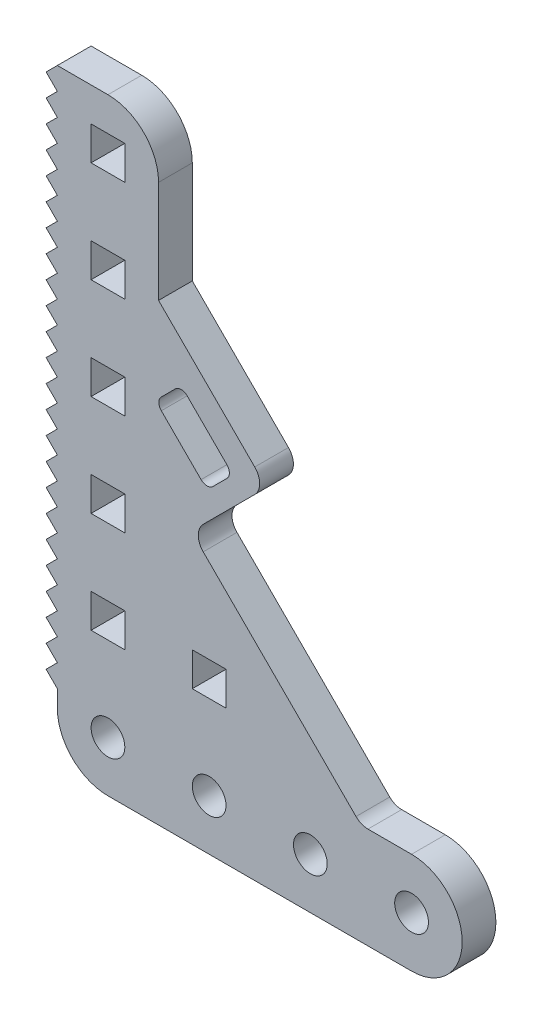
from build123d import *

# Parameters (mm, degrees)
MODEL_R                 = 1.5
MODEL_W                 = 3
MODEL_H                 = 3
SALIENTE_EXTRUIR1_DEPTH = 3


with BuildPart() as part:
    # Model → Saliente-Extruir1 (new body)
    with BuildSketch(Plane.XY):
        with BuildLine():
            Line((20.979107628, 285.503511394), (19.979107628, 286.503511394))
            Line((19.979107628, 286.503511394), (20.979107628, 287.503511394))
            Line((20.979107628, 287.503511394), (25.479107628, 287.503511394))
            ThreePointArc((25.479107628, 287.503511394), (28.661088143, 286.185491909), (29.979107628, 283.003511394))
            Line((29.979107628, 283.003511394), (29.979107628, 273.910365643))
            Line((29.979107628, 273.910365643), (38.532408487, 265.357064784))
            ThreePointArc((38.532408487, 265.357064784), (38.971748315, 264.296404613), (38.532408487, 263.235744441))
            Line((38.532408487, 263.235744441), (33.950301706, 258.65363766))
            ThreePointArc((33.950301706, 258.65363766), (33.510961878, 257.592977488), (33.950301706, 256.532317316))
            Line((33.950301706, 256.532317316), (47.5397678, 242.942851222))
            ThreePointArc((47.5397678, 242.942851222), (48.026402823, 242.617692095), (48.600427972, 242.503511394))
            Line((48.600427972, 242.503511394), (52.479107628, 242.503511394))
            ThreePointArc((52.479107628, 242.503511394), (56.979107628, 238.003511394), (52.479107628, 233.503511394))
            Line((52.479107628, 233.503511394), (25.479107628, 233.503511394))
            ThreePointArc((25.479107628, 233.503511394), (22.297127113, 234.821530879), (20.979107628, 238.003511394))
            Line((20.979107628, 238.003511394), (20.979107628, 239.503511394))
            Line((20.979107628, 239.503511394), (19.979107628, 240.503511394))
            Line((19.979107628, 240.503511394), (20.979107628, 241.503511394))
            Line((20.979107628, 241.503511394), (19.979107628, 242.503511394))
            Line((19.979107628, 242.503511394), (20.979107628, 243.503511394))
            Line((20.979107628, 243.503511394), (19.979107628, 244.503511394))
            Line((19.979107628, 244.503511394), (20.979107628, 245.503511394))
            Line((20.979107628, 245.503511394), (19.979107628, 246.503511394))
            Line((19.979107628, 246.503511394), (20.979107628, 247.503511394))
            Line((20.979107628, 247.503511394), (19.979107628, 248.503511394))
            Line((19.979107628, 248.503511394), (20.979107628, 249.503511394))
            Line((20.979107628, 249.503511394), (19.979107628, 250.503511394))
            Line((19.979107628, 250.503511394), (20.979107628, 251.503511394))
            Line((20.979107628, 251.503511394), (19.979107628, 252.503511394))
            Line((19.979107628, 252.503511394), (20.979107628, 253.503511394))
            Line((20.979107628, 253.503511394), (19.979107628, 254.503511394))
            Line((19.979107628, 254.503511394), (20.979107628, 255.503511394))
            Line((20.979107628, 255.503511394), (19.979107628, 256.503511394))
            Line((19.979107628, 256.503511394), (20.979107628, 257.503511394))
            Line((20.979107628, 257.503511394), (19.979107628, 258.503511394))
            Line((19.979107628, 258.503511394), (20.979107628, 259.503511394))
            Line((20.979107628, 259.503511394), (19.979107628, 260.503511394))
            Line((19.979107628, 260.503511394), (20.979107628, 261.503511394))
            Line((20.979107628, 261.503511394), (19.979107628, 262.503511394))
            Line((19.979107628, 262.503511394), (20.979107628, 263.503511394))
            Line((20.979107628, 263.503511394), (19.979107628, 264.503511394))
            Line((19.979107628, 264.503511394), (20.979107628, 265.503511394))
            Line((20.979107628, 265.503511394), (19.979107628, 266.503511394))
            Line((19.979107628, 266.503511394), (20.979107628, 267.503511394))
            Line((20.979107628, 267.503511394), (19.979107628, 268.503511394))
            Line((19.979107628, 268.503511394), (20.979107628, 269.503511394))
            Line((20.979107628, 269.503511394), (19.979107628, 270.503511394))
            Line((19.979107628, 270.503511394), (20.979107628, 271.503511394))
            Line((20.979107628, 271.503511394), (19.979107628, 272.503511394))
            Line((19.979107628, 272.503511394), (20.979107628, 273.503511394))
            Line((20.979107628, 273.503511394), (19.979107628, 274.503511394))
            Line((19.979107628, 274.503511394), (20.979107628, 275.503511394))
            Line((20.979107628, 275.503511394), (19.979107628, 276.503511394))
            Line((19.979107628, 276.503511394), (20.979107628, 277.503511394))
            Line((20.979107628, 277.503511394), (19.979107628, 278.503511394))
            Line((19.979107628, 278.503511394), (20.979107628, 279.503511394))
            Line((20.979107628, 279.503511394), (19.979107628, 280.503511394))
            Line((19.979107628, 280.503511394), (20.979107628, 281.503511394))
            Line((20.979107628, 281.503511394), (19.979107628, 282.503511394))
            Line((19.979107628, 282.503511394), (20.979107628, 283.503511394))
            Line((20.979107628, 283.503511394), (19.979107628, 284.503511394))
            Line((19.979107628, 284.503511394), (20.979107628, 285.503511394))
        make_face()
        with Locations((43.479107628, 238.003511394)):
            Circle(MODEL_R, mode=Mode.SUBTRACT)
        with Locations((34.479107628, 238.003511394)):
            Circle(MODEL_R, mode=Mode.SUBTRACT)
        with Locations((52.479107628, 238.003511394)):
            Circle(MODEL_R, mode=Mode.SUBTRACT)
        with Locations((25.479107628, 238.003511394)):
            Circle(MODEL_R, mode=Mode.SUBTRACT)
        with Locations((25.479107628, 283.003511394)):
            Rectangle(MODEL_W, MODEL_H, mode=Mode.SUBTRACT)
        with Locations((25.479107628, 247.003511394)):
            Rectangle(MODEL_W, MODEL_H, mode=Mode.SUBTRACT)
        with Locations((25.479107628, 274.003511394)):
            Rectangle(MODEL_W, MODEL_H, mode=Mode.SUBTRACT)
        with Locations((25.479107628, 256.003511394)):
            Rectangle(MODEL_W, MODEL_H, mode=Mode.SUBTRACT)
        with Locations((25.479107628, 265.003511394)):
            Rectangle(MODEL_W, MODEL_H, mode=Mode.SUBTRACT)
        with Locations((34.479107628, 247.003511394)):
            Rectangle(MODEL_W, MODEL_H, mode=Mode.SUBTRACT)
        with BuildLine():
            Line((36.057534753, 263.235744441), (34.820097886, 261.998307574))
            ThreePointArc((34.820097886, 261.998307574), (34.2897678, 261.77863766), (33.759437714, 261.998307574))
            Line((33.759437714, 261.998307574), (30.223903808, 265.53384148))
            ThreePointArc((30.223903808, 265.53384148), (30.004233894, 266.064171566), (30.223903808, 266.594501652))
            Line((30.223903808, 266.594501652), (31.461340675, 267.831938519))
            ThreePointArc((31.461340675, 267.831938519), (31.991670761, 268.051608433), (32.522000847, 267.831938519))
            Line((32.522000847, 267.831938519), (36.057534753, 264.296404613))
            ThreePointArc((36.057534753, 264.296404613), (36.277204667, 263.766074527), (36.057534753, 263.235744441))
        make_face(mode=Mode.SUBTRACT)
    extrude(amount=SALIENTE_EXTRUIR1_DEPTH)


solid = part.part
